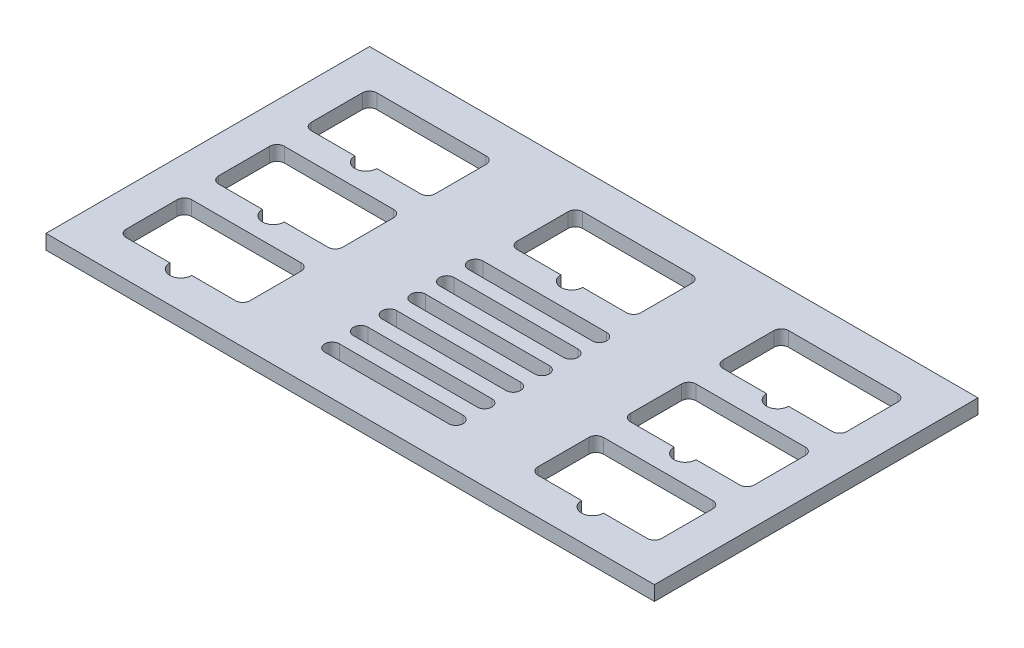
from build123d import *

# Parameters (mm, degrees)
SKETCH1_W           = 83.5
SKETCH1_H           = 44.4
BOSS_EXTRUDE1_DEPTH = 2


with BuildPart() as part:
    # Sketch1 → Boss-Extrude1 (new body)
    with BuildSketch(Plane(origin=(0, 0, 0), x_dir=(1, 0, 0), z_dir=(0, 1, 0))):
        with Locations((36.75, -17.2)):
            Rectangle(SKETCH1_W, SKETCH1_H)
        with BuildLine():
            Line((29.25, -9), (35.25, -9))
            ThreePointArc((35.25, -9), (36.75, -10.5), (38.25, -9))
            Line((38.25, -9), (44.25, -9))
            ThreePointArc((44.25, -9), (44.957106781, -8.707106781), (45.25, -8))
            Line((45.25, -8), (45.25, -1))
            ThreePointArc((45.25, -1), (44.957106781, -0.292893219), (44.25, 0))
            Line((44.25, 0), (29.25, 0))
            ThreePointArc((29.25, 0), (28.542893219, -0.292893219), (28.25, -1))
            Line((28.25, -1), (28.25, -8))
            ThreePointArc((28.25, -8), (28.542893219, -8.707106781), (29.25, -9))
        make_face(mode=Mode.SUBTRACT)
        with BuildLine():
            Line((1, 0), (16, 0))
            ThreePointArc((16, 0), (16.707106781, -0.292893219), (17, -1))
            Line((17, -1), (17, -8))
            ThreePointArc((17, -8), (16.707106781, -8.707106781), (16, -9))
            Line((16, -9), (10, -9))
            ThreePointArc((10, -9), (8.5, -10.5), (7, -9))
            Line((7, -9), (1, -9))
            ThreePointArc((1, -9), (0.292893219, -8.707106781), (0, -8))
            Line((0, -8), (0, -1))
            ThreePointArc((0, -1), (0.292893219, -0.292893219), (1, 0))
        make_face(mode=Mode.SUBTRACT)
        with BuildLine():
            Line((57.5, -9), (63.5, -9))
            ThreePointArc((63.5, -9), (65, -10.5), (66.5, -9))
            Line((66.5, -9), (72.5, -9))
            ThreePointArc((72.5, -9), (73.207106781, -8.707106781), (73.5, -8))
            Line((73.5, -8), (73.5, -1))
            ThreePointArc((73.5, -1), (73.207106781, -0.292893219), (72.5, 0))
            Line((72.5, 0), (57.5, 0))
            ThreePointArc((57.5, 0), (56.792893219, -0.292893219), (56.5, -1))
            Line((56.5, -1), (56.5, -8))
            ThreePointArc((56.5, -8), (56.792893219, -8.707106781), (57.5, -9))
        make_face(mode=Mode.SUBTRACT)
        with BuildLine():
            Line((57.5, -21.7), (63.5, -21.7))
            ThreePointArc((63.5, -21.7), (65, -23.2), (66.5, -21.7))
            Line((66.5, -21.7), (72.5, -21.7))
            ThreePointArc((72.5, -21.7), (73.207106781, -21.407106781), (73.5, -20.7))
            Line((73.5, -20.7), (73.5, -13.7))
            ThreePointArc((73.5, -13.7), (73.207106781, -12.992893219), (72.5, -12.7))
            Line((72.5, -12.7), (57.5, -12.7))
            ThreePointArc((57.5, -12.7), (56.792893219, -12.992893219), (56.5, -13.7))
            Line((56.5, -13.7), (56.5, -20.7))
            ThreePointArc((56.5, -20.7), (56.792893219, -21.407106781), (57.5, -21.7))
        make_face(mode=Mode.SUBTRACT)
        with BuildLine():
            Line((57.5, -34.4), (63.5, -34.4))
            ThreePointArc((63.5, -34.4), (65, -35.9), (66.5, -34.4))
            Line((66.5, -34.4), (72.5, -34.4))
            ThreePointArc((72.5, -34.4), (73.207106781, -34.107106781), (73.5, -33.4))
            Line((73.5, -33.4), (73.5, -26.4))
            ThreePointArc((73.5, -26.4), (73.207106781, -25.692893219), (72.5, -25.4))
            Line((72.5, -25.4), (57.5, -25.4))
            ThreePointArc((57.5, -25.4), (56.792893219, -25.692893219), (56.5, -26.4))
            Line((56.5, -26.4), (56.5, -33.4))
            ThreePointArc((56.5, -33.4), (56.792893219, -34.107106781), (57.5, -34.4))
        make_face(mode=Mode.SUBTRACT)
        with BuildLine():
            Line((1, -21.7), (7, -21.7))
            ThreePointArc((7, -21.7), (8.5, -23.2), (10, -21.7))
            Line((10, -21.7), (16, -21.7))
            ThreePointArc((16, -21.7), (16.707106781, -21.407106781), (17, -20.7))
            Line((17, -20.7), (17, -13.7))
            ThreePointArc((17, -13.7), (16.707106781, -12.992893219), (16, -12.7))
            Line((16, -12.7), (1, -12.7))
            ThreePointArc((1, -12.7), (0.292893219, -12.992893219), (0, -13.7))
            Line((0, -13.7), (0, -20.7))
            ThreePointArc((0, -20.7), (0.292893219, -21.407106781), (1, -21.7))
        make_face(mode=Mode.SUBTRACT)
        with BuildLine():
            Line((1, -34.4), (7, -34.4))
            ThreePointArc((7, -34.4), (8.5, -35.9), (10, -34.4))
            Line((10, -34.4), (16, -34.4))
            ThreePointArc((16, -34.4), (16.707106781, -34.107106781), (17, -33.4))
            Line((17, -33.4), (17, -26.4))
            ThreePointArc((17, -26.4), (16.707106781, -25.692893219), (16, -25.4))
            Line((16, -25.4), (1, -25.4))
            ThreePointArc((1, -25.4), (0.292893219, -25.692893219), (0, -26.4))
            Line((0, -26.4), (0, -33.4))
            ThreePointArc((0, -33.4), (0.292893219, -34.107106781), (1, -34.4))
        make_face(mode=Mode.SUBTRACT)
        with BuildLine():
            Line((28.25, -16.64), (45.25, -16.64))
            ThreePointArc((45.25, -16.64), (46.25, -17.64), (45.25, -18.64))
            Line((45.25, -18.64), (28.25, -18.64))
            ThreePointArc((28.25, -18.64), (27.25, -17.64), (28.25, -16.64))
        make_face(mode=Mode.SUBTRACT)
        with BuildLine():
            Line((28.25, -12.7), (45.25, -12.7))
            ThreePointArc((45.25, -12.7), (46.25, -13.7), (45.25, -14.7))
            Line((45.25, -14.7), (28.25, -14.7))
            ThreePointArc((28.25, -14.7), (27.25, -13.7), (28.25, -12.7))
        make_face(mode=Mode.SUBTRACT)
        with BuildLine():
            Line((28.25, -20.58), (45.25, -20.58))
            ThreePointArc((45.25, -20.58), (46.25, -21.58), (45.25, -22.58))
            Line((45.25, -22.58), (28.25, -22.58))
            ThreePointArc((28.25, -22.58), (27.25, -21.58), (28.25, -20.58))
        make_face(mode=Mode.SUBTRACT)
        with BuildLine():
            Line((28.25, -24.52), (45.25, -24.52))
            ThreePointArc((45.25, -24.52), (46.25, -25.52), (45.25, -26.52))
            Line((45.25, -26.52), (28.25, -26.52))
            ThreePointArc((28.25, -26.52), (27.25, -25.52), (28.25, -24.52))
        make_face(mode=Mode.SUBTRACT)
        with BuildLine():
            Line((28.25, -28.46), (45.25, -28.46))
            ThreePointArc((45.25, -28.46), (46.25, -29.46), (45.25, -30.46))
            Line((45.25, -30.46), (28.25, -30.46))
            ThreePointArc((28.25, -30.46), (27.25, -29.46), (28.25, -28.46))
        make_face(mode=Mode.SUBTRACT)
        with BuildLine():
            Line((28.25, -32.4), (45.25, -32.4))
            ThreePointArc((45.25, -32.4), (46.25, -33.4), (45.25, -34.4))
            Line((45.25, -34.4), (28.25, -34.4))
            ThreePointArc((28.25, -34.4), (27.25, -33.4), (28.25, -32.4))
        make_face(mode=Mode.SUBTRACT)
    extrude(amount=BOSS_EXTRUDE1_DEPTH)


solid = part.part
